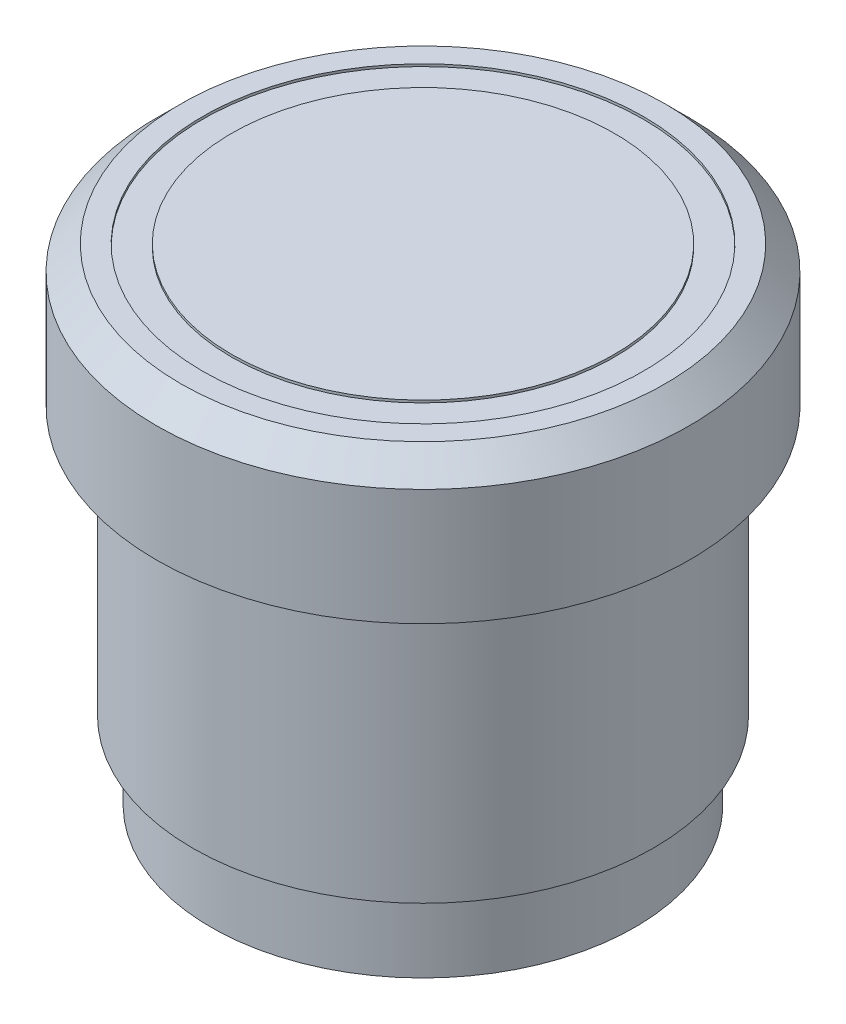
from build123d import *

# Parameters (mm, degrees)
SKETCH2_R          = 9.1
SKETCH2_R_2        = 7.9
CUT_EXTRUDE1_DEPTH = 0.1
CHAMFER1_SIZE      = 1


with BuildPart() as part:
    # Sketch1 → Revolve1 (revolve)
    with BuildSketch(Plane(origin=(0, 0, 0), x_dir=(0, 0, -1), z_dir=(1, 0, 0))):
        Polygon((0, 20.05), (11, 20.05), (11, 14.25), (9.5, 14.25), (9.5, 3.2), (8.75, 3.2), (8.75, 0), (0, 0), align=None)
    revolve(axis=Axis((0, 0, 0), (0, 1, 0)))

    # Sketch2 → Cut-Extrude1 (cut)
    with BuildSketch(Plane(origin=(0, 20.05, 0), x_dir=(1, 0, 0), z_dir=(0, 1, 0))):
        with Locations(Location((0, 0, 0), (0, 0, 270))):
            Circle(SKETCH2_R)
        with Locations(Location((0, 0, 0), (0, 0, 270))):
            Circle(SKETCH2_R_2, mode=Mode.SUBTRACT)
    extrude(amount=-CUT_EXTRUDE1_DEPTH, mode=Mode.SUBTRACT)

    # Chamfer1
    chamfer1_edges = [part.edges().sort_by_distance(p)[0] for p in [
        (0, 20.05, 11),
    ]]
    chamfer(chamfer1_edges, length=CHAMFER1_SIZE)


solid = part.part
